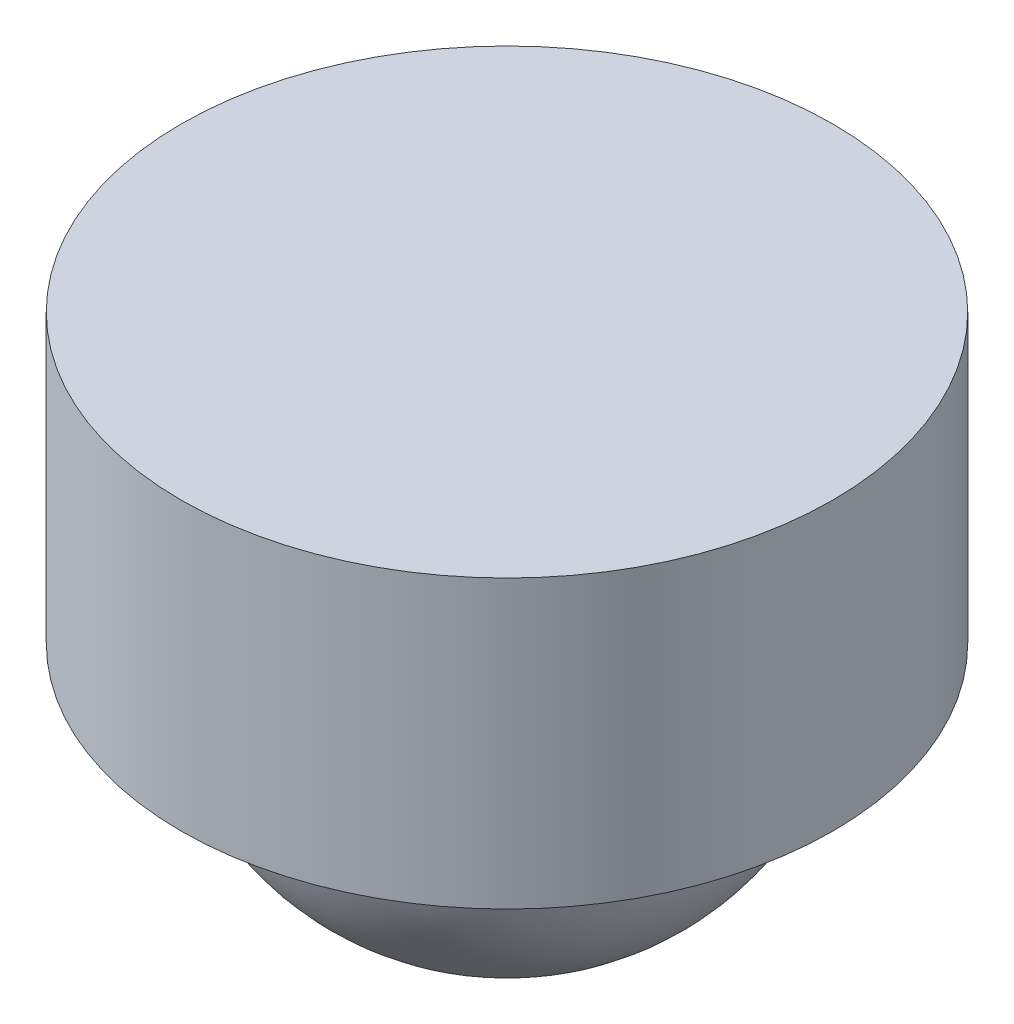
from build123d import *

# Parameters (mm, degrees)
SKETCH2_R           = 12.5
BOSS_EXTRUDE1_DEPTH = 11


with BuildPart() as part:
    # Sketch1 → Revolve1 (revolve)
    with BuildSketch(Plane.XY):
        with BuildLine():
            Line((0, 19), (0, 0))
            ThreePointArc((0, 0), (-9.5, 9.5), (0, 19))
        make_face()
    revolve(axis=Axis((0, 0, 0), (0, 1, 0)))


with BuildPart() as body_2:
    # Sketch2 → Boss-Extrude1 (new body)
    with BuildSketch(Plane(origin=(0, 9, 0), x_dir=(1, 0, 0), z_dir=(0, 1, 0))):
        with Locations(Location((0, 0, 0), (0, 0, 270))):
            Circle(SKETCH2_R)
    extrude(amount=BOSS_EXTRUDE1_DEPTH)


solid = Compound([part.part, body_2.part])
